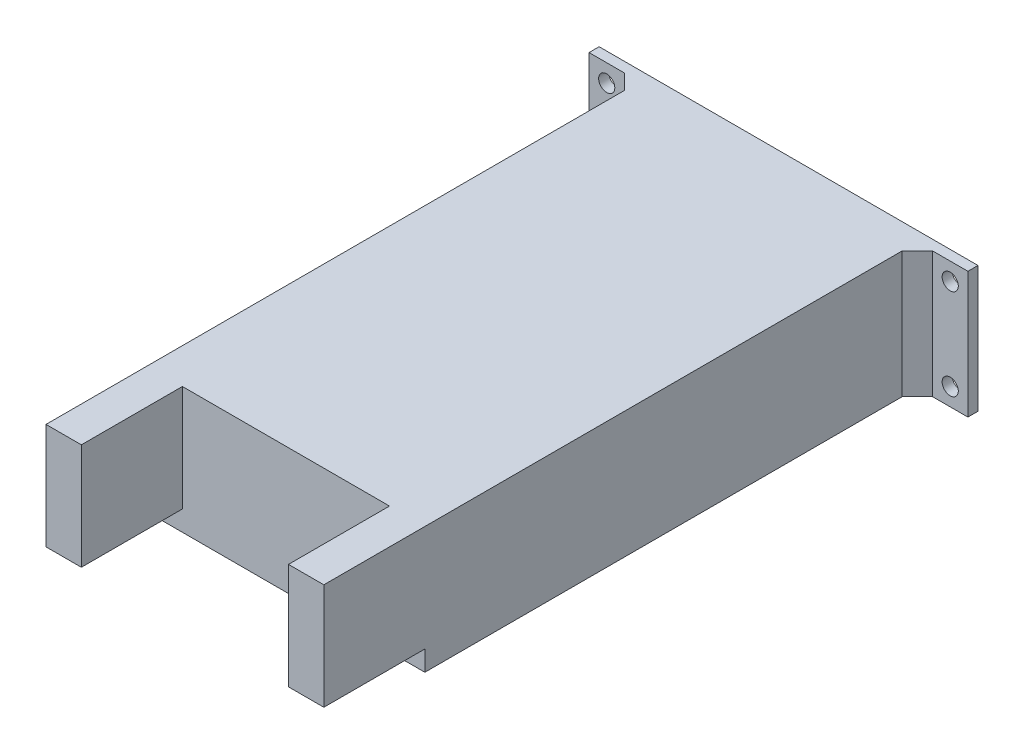
from build123d import *

# Parameters (mm, degrees)
SKETCH_1_W          = 55
SKETCH_1_H          = 25
EXTRUDE_1_DEPTH     = 119.5
SKETCH_3_W          = 2
SKETCH_3_H          = 25
EXTRUDE_2_DEPTH     = 10
EXTRUDE_3_DEPTH     = 25
SKETCH_6_R          = 1.6
CUT_EXTRUDE_2_DEPTH = 131.118748168
SKETCH_7_W          = 2
SKETCH_7_H          = 25
EXTRUDE_4_DEPTH     = 10
EXTRUDE_5_DEPTH     = 25
SKETCH_9_R          = 1.6
CUT_EXTRUDE_3_DEPTH = 131.118748168
SKETCH_10_W         = 55
SKETCH_10_H         = 4
CUT_EXTRUDE_4_DEPTH = 20
SKETCH_12_W         = 41
SKETCH_12_H         = 21
CUT_EXTRUDE_5_DEPTH = 20
SKETCH_13_R         = 1.4
CUT_EXTRUDE_6_DEPTH = 10
SKETCH_15_R         = 1.4
CUT_EXTRUDE_7_DEPTH = 10


with BuildPart() as part:
    # ｽｹｯﾁ1 → ﾎﾞｽ - 押し出し1 (new body)
    with BuildSketch(Plane.XY):
        with Locations((14.77105538, -7.308467742)):
            Rectangle(SKETCH_1_W, SKETCH_1_H)
    extrude(amount=EXTRUDE_1_DEPTH)

    # ｽｹｯﾁ3 → ﾎﾞｽ - 押し出し2 (add)
    with BuildSketch(Plane(origin=(42.27105538, 0, 0), x_dir=(0, 0, -1), z_dir=(1, 0, 0))):
        with Locations((-1, -7.308467742)):
            Rectangle(SKETCH_3_W, SKETCH_3_H)
    extrude(amount=EXTRUDE_2_DEPTH)

    # ｽｹｯﾁ5 → ﾎﾞｽ - 押し出し3 (add, through all)
    with BuildSketch(Plane(origin=(0, 5.191532258, 0), x_dir=(1, 0, 0), z_dir=(0, 1, 0))):
        Polygon((42.27105538, -5), (45.27105538, -2), (42.27105538, -2), align=None)
    extrude(amount=-EXTRUDE_3_DEPTH)

    # ｽｹｯﾁ6 → ｶｯﾄ - 押し出し2 (cut, through all)
    with BuildSketch(Plane.XY.offset(2)):
        with Locations((48.77105538, 1.691532258)):
            Circle(SKETCH_6_R)
        with Locations((48.77105538, -16.308467742)):
            Circle(SKETCH_6_R)
    extrude(amount=-CUT_EXTRUDE_2_DEPTH, mode=Mode.SUBTRACT)

    # ｽｹｯﾁ7 → ﾎﾞｽ - 押し出し4 (add)
    with BuildSketch(Plane.ZY.offset(12.72894462)):
        with Locations((1, -7.308467742)):
            Rectangle(SKETCH_7_W, SKETCH_7_H)
    extrude(amount=EXTRUDE_4_DEPTH)

    # ｽｹｯﾁ8 → ﾎﾞｽ - 押し出し5 (add, through all)
    with BuildSketch(Plane.XZ.offset(19.808467742)):
        Polygon((-12.72894462, 5), (-15.72894462, 2), (-12.72894462, 2), align=None)
    extrude(amount=-EXTRUDE_5_DEPTH)

    # ｽｹｯﾁ9 → ｶｯﾄ - 押し出し3 (cut, through all)
    with BuildSketch(Plane.XY.offset(2)):
        with Locations((-19.22894462, -16.308467742)):
            Circle(SKETCH_9_R)
        with Locations((-19.22894462, 1.691532258)):
            Circle(SKETCH_9_R)
    extrude(amount=-CUT_EXTRUDE_3_DEPTH, mode=Mode.SUBTRACT)

    # ｽｹｯﾁ10 → ｶｯﾄ - 押し出し4 (cut)
    with BuildSketch(Plane.XY.offset(119.5)):
        with Locations((14.77105538, -17.808467742)):
            Rectangle(SKETCH_10_W, SKETCH_10_H)
    extrude(amount=-CUT_EXTRUDE_4_DEPTH, mode=Mode.SUBTRACT)

    # ｽｹｯﾁ12 → ｶｯﾄ - 押し出し5 (cut)
    with BuildSketch(Plane.XY.offset(119.5)):
        with Locations((14.77105538, -5.308467742)):
            Rectangle(SKETCH_12_W, SKETCH_12_H)
    extrude(amount=-CUT_EXTRUDE_5_DEPTH, mode=Mode.SUBTRACT)

    # ｽｹｯﾁ13 → ｶｯﾄ - 押し出し6 (cut)
    with BuildSketch(Plane.XZ.offset(15.808467742)):
        with Locations((39.27105538, 104.5)):
            Circle(SKETCH_13_R)
        with Locations((39.27105538, 114.5)):
            Circle(SKETCH_13_R)
    extrude(amount=-CUT_EXTRUDE_6_DEPTH, mode=Mode.SUBTRACT)

    # ｽｹｯﾁ15 → ｶｯﾄ - 押し出し7 (cut)
    with BuildSketch(Plane(origin=(0, -15.808467742, 0), x_dir=(-1, 0, 0), z_dir=(0, -1, 0))):
        with Locations(Location((9.72894462, -104.5, 0), (0, 0, 180))):
            Circle(SKETCH_15_R)
        with Locations(Location((9.72894462, -114.5, 0), (0, 0, 180))):
            Circle(SKETCH_15_R)
    extrude(amount=-CUT_EXTRUDE_7_DEPTH, mode=Mode.SUBTRACT)


solid = part.part
